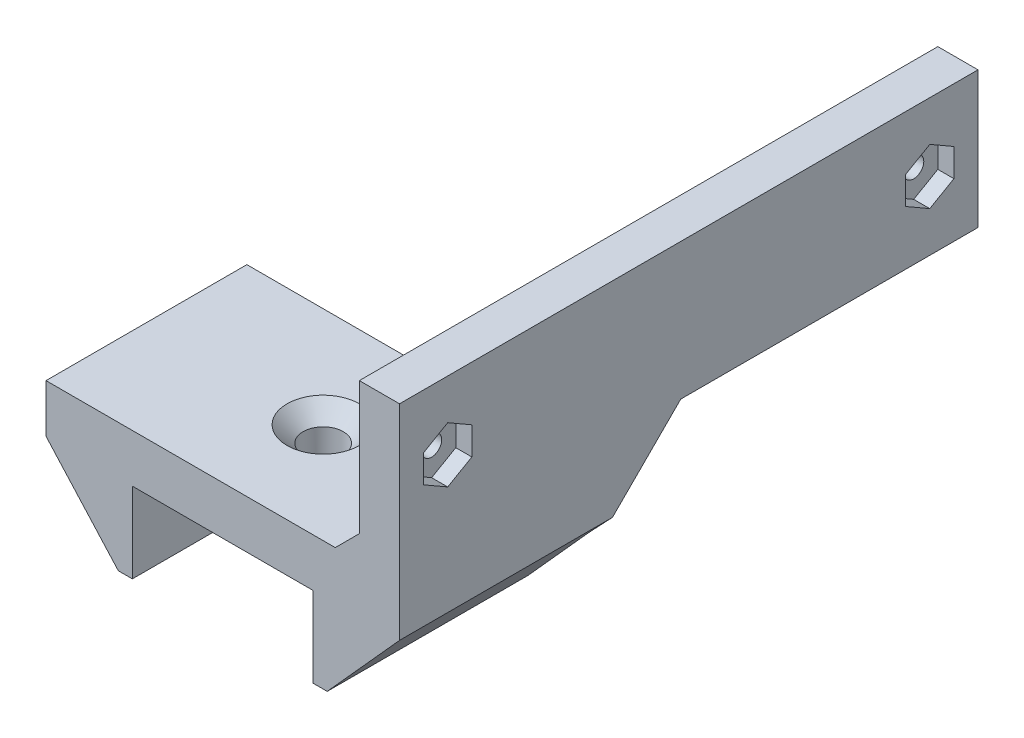
from build123d import *

# Parameters (mm, degrees)
BOSS_EXTRUDE1_DEPTH = 25
SKETCH2_R           = 1.25
BOSS_EXTRUDE2_DEPTH = 5
SKETCH3_R           = 2.5
CUT_EXTRUDE1_DEPTH  = 56.436901068
CHAMFER1_SIZE       = 2
CUT_EXTRUDE2_DEPTH  = 2
CHAMFER2_SIZE       = 3
SKETCH5_W           = 0.5
SKETCH5_H           = 47
CUT_EXTRUDE3_DEPTH  = 56.093103017
CHAMFER3_SIZE       = 10


with BuildPart() as part:
    # Sketch1 → Boss-Extrude1 (new body)
    with BuildSketch(Plane.XY):
        Polygon((-11.25, 0), (11.25, 0), (11.25, -10), (13, -10), (22, 0), (22, 6), (-22, 6), (-22, 0), (-13, -10), (-11.25, -10), align=None)
    extrude(amount=BOSS_EXTRUDE1_DEPTH)

    # Sketch2 → Boss-Extrude2 (add)
    with BuildSketch(Plane(origin=(22, 0, 0), x_dir=(0, 0, -1), z_dir=(1, 0, 0))):
        Polygon((-25, 6), (0, 6), (0, 8.5), (47, 8.5), (47, 25.5), (-25, 25.5), align=None)
        with Locations((-19, 17)):
            Circle(SKETCH2_R, mode=Mode.SUBTRACT)
        with Locations((41, 17)):
            Circle(SKETCH2_R, mode=Mode.SUBTRACT)
    extrude(amount=-BOSS_EXTRUDE2_DEPTH)

    # Sketch3 → Cut-Extrude1 (cut, through all)
    with BuildSketch(Plane(origin=(0, 6, 0), x_dir=(1, 0, 0), z_dir=(0, 1, 0))):
        with Locations(Location((0, -12.5, 0), (0, 0, 270))):
            Circle(SKETCH3_R)
    extrude(amount=-CUT_EXTRUDE1_DEPTH, mode=Mode.SUBTRACT)

    # Chamfer1
    chamfer1_edges = [part.edges().sort_by_distance(p)[0] for p in [
        (0, 6, 10),
    ]]
    chamfer(chamfer1_edges, length=CHAMFER1_SIZE)

    # Sketch4 → Cut-Extrude2 (cut)
    with BuildSketch(Plane(origin=(22, 0, 0), x_dir=(0, 0, -1), z_dir=(1, 0, 0))):
        Polygon((-16, 18.732050808), (-16, 15.267949192), (-19, 13.535898385), (-22, 15.267949192), (-22, 18.732050808), (-19, 20.464101615), align=None)
    cut_extrude2 = extrude(amount=-CUT_EXTRUDE2_DEPTH, mode=Mode.SUBTRACT)

    # Mirror1: Cut-Extrude2 across plane
    add(cut_extrude2.mirror(Plane.XY.offset(-11)), mode=Mode.SUBTRACT)

    # Chamfer2
    chamfer2_edges = [part.edges().sort_by_distance(p)[0] for p in [
        (17, 6, 12.5),
    ]]
    chamfer(chamfer2_edges, length=CHAMFER2_SIZE)

    # Sketch5 → Cut-Extrude3 (cut, through all)
    with BuildSketch(Plane.XZ.offset(-8.5)):
        with Locations((16.75, -23.5)):
            Rectangle(SKETCH5_W, SKETCH5_H)
    extrude(amount=-CUT_EXTRUDE3_DEPTH, mode=Mode.SUBTRACT)

    # Chamfer3
    chamfer3_edges = [part.edges().sort_by_distance(p)[0] for p in [
        (19.5, 8.5, 0),
    ]]
    chamfer(chamfer3_edges, length=CHAMFER3_SIZE)


solid = part.part
